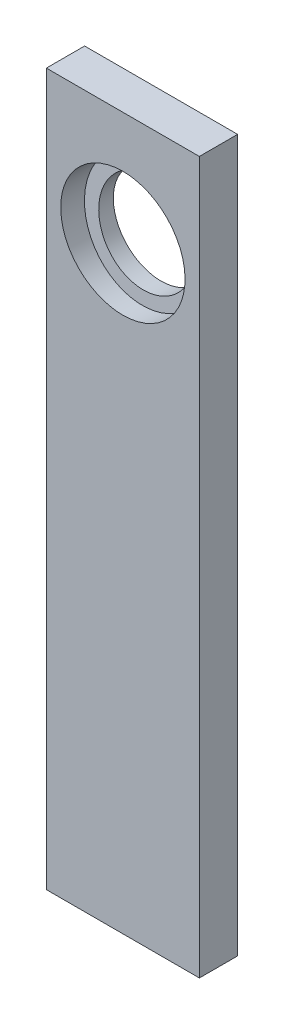
from build123d import *

# Parameters (mm, degrees)
SKETCH1_W           = 80
SKETCH1_H           = 372
BOSS_EXTRUDE1_DEPTH = 20
SKETCH4_R           = 32.5
CUT_EXTRUDE2_DEPTH  = 193.049397179
SKETCH5_R           = 25
CUT_EXTRUDE3_DEPTH  = 193.049397179


with BuildPart() as part:
    # Sketch1 → Boss-Extrude1 (new body)
    with BuildSketch(Plane.XY):
        Rectangle(SKETCH1_W, SKETCH1_H)
    extrude(amount=BOSS_EXTRUDE1_DEPTH)

    # Sketch4 → Cut-Extrude2 (cut, through all)
    with BuildSketch(Plane(origin=(0, 1.135010798, 16.231410618), x_dir=(1, 0, 0), z_dir=(0, -0.06975647374412888, -0.997564050259824))):
        with Locations(Location((0, -124.995505595, 0), (0, 0, 270))):
            Circle(SKETCH4_R)
    extrude(amount=-CUT_EXTRUDE2_DEPTH, mode=Mode.SUBTRACT)

    # Sketch5 → Cut-Extrude3 (cut, through all)
    with BuildSketch(Plane(origin=(0, 1.135010798, 16.231410618), x_dir=(1, 0, 0), z_dir=(0, 0.06975647374412888, 0.9975640502598241))):
        with Locations(Location((0, 124.297940858, 0), (0, 0, 270))):
            Circle(SKETCH5_R)
    extrude(amount=-CUT_EXTRUDE3_DEPTH, mode=Mode.SUBTRACT)


solid = part.part
